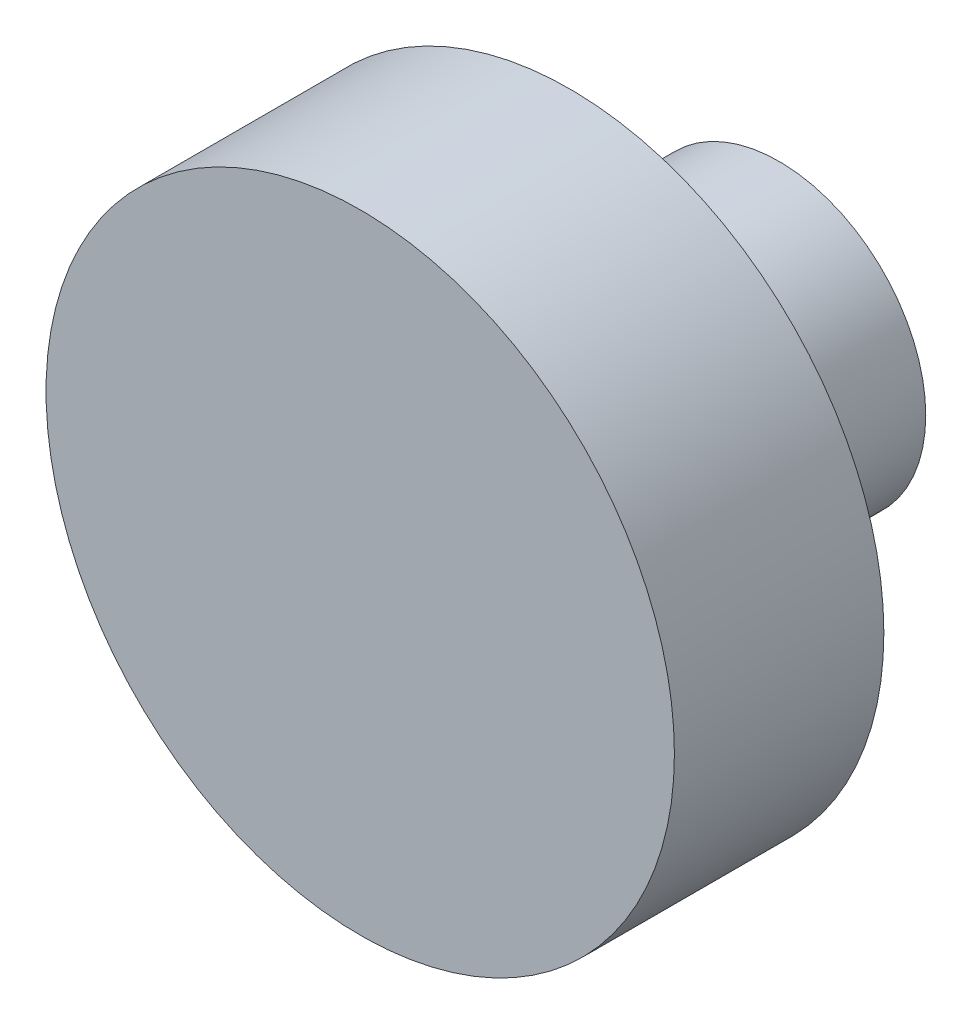
from build123d import *

# Parameters (mm, degrees)
SKETCH_1_R      = 1.4
EXTRUDE_1_DEPTH = 2
SKETCH_2_R      = 3
EXTRUDE_2_DEPTH = 2


with BuildPart() as part:
    # Эскиз1 → Бобышка-Вытянуть1 (new body)
    with BuildSketch(Plane.XY):
        Circle(SKETCH_1_R)
    extrude(amount=EXTRUDE_1_DEPTH)

    # Эскиз2 → Бобышка-Вытянуть2 (add)
    with BuildSketch(Plane.XY.offset(2)):
        Circle(SKETCH_2_R)
    extrude(amount=EXTRUDE_2_DEPTH)


solid = part.part
